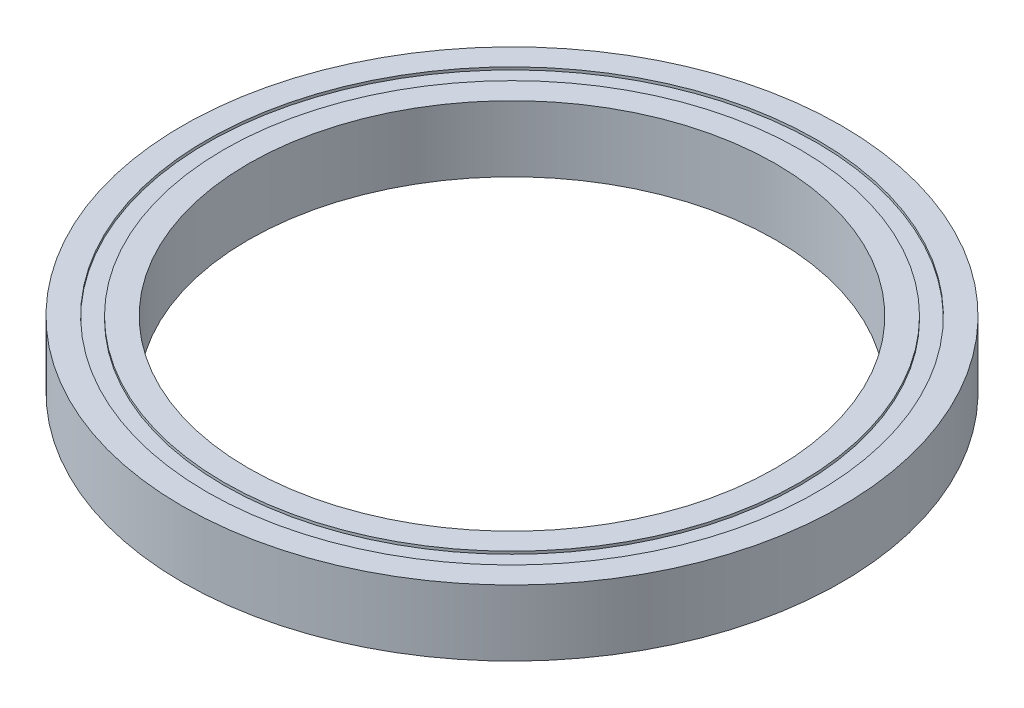
from build123d import *

# Parameters (mm, degrees)
EXTRUDE_1_DEPTH      = 3.175
EXTRUDE_1_DEPTH_BACK = 3.175
SKETCH_1_R           = 31.75
SKETCH_1_R_2         = 25.4
SKETCH_2_R           = 29.3878
SKETCH_2_R_2         = 27.7622
CUT_EXTRUDE_1_DEPTH  = 0.254


with BuildPart() as part:
    # ｽｹｯﾁ1 → ﾎﾞｽ - 押し出し1 (new, two sides: drawn at the far end of the back side and taken through both)
    with BuildSketch(Plane(origin=(0, 0, 0), x_dir=(1, 0, 0), z_dir=(0, 1, 0)).offset(-EXTRUDE_1_DEPTH_BACK)):
        Circle(SKETCH_1_R)
        Circle(SKETCH_1_R_2, mode=Mode.SUBTRACT)
    extrude(amount=EXTRUDE_1_DEPTH + EXTRUDE_1_DEPTH_BACK)

    # ｽｹｯﾁ2 → ｶｯﾄ - 押し出し1 (cut)
    with BuildSketch(Plane(origin=(0, 3.175, 0), x_dir=(1, 0, 0), z_dir=(0, 1, 0))):
        Circle(SKETCH_2_R)
        Circle(SKETCH_2_R_2, mode=Mode.SUBTRACT)
    cut_extrude_1 = extrude(amount=-CUT_EXTRUDE_1_DEPTH, mode=Mode.SUBTRACT)

    # ﾐﾗｰ1: ｶｯﾄ - 押し出し1 across plane
    add(cut_extrude_1.mirror(Plane.ZX), mode=Mode.SUBTRACT)


solid = part.part
